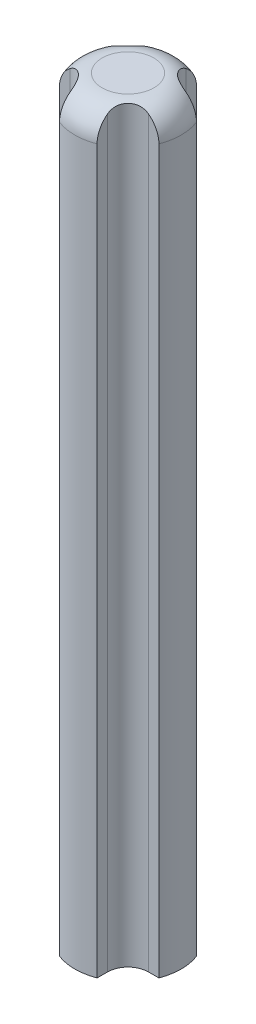
from build123d import *

# Parameters (mm, degrees)
SKETCH1_R           = 3.9
BOSS_EXTRUDE1_DEPTH = 55
FILLET1_R           = 2
SKETCH2_W           = 2.5
SKETCH2_H           = 2.5
CUT_EXTRUDE1_DEPTH  = 56.27585368
CIRPATTERN1_COUNT   = 4
FILLET2_R           = 1.5


with BuildPart() as part:
    # Sketch1 → Boss-Extrude1 (new body)
    with BuildSketch(Plane(origin=(0, 0, 0), x_dir=(1, 0, 0), z_dir=(0, 1, 0))):
        with Locations(Location((0, 0, 0), (0, 0, 270))):
            Circle(SKETCH1_R)
    extrude(amount=BOSS_EXTRUDE1_DEPTH)

    # Fillet1
    fillet1_edges = [part.edges().sort_by_distance(p)[0] for p in [
        (0, 55, -3.9),
    ]]
    fillet(fillet1_edges, radius=FILLET1_R)

    # Sketch2 → Cut-Extrude1 (cut, through all)
    with BuildSketch(Plane(origin=(0, 55, 0), x_dir=(1, 0, 0), z_dir=(0, 1, 0))):
        with Locations((2.628858223, -2.628858223)):
            Rectangle(SKETCH2_W, SKETCH2_H)
    cut_extrude1 = extrude(amount=-CUT_EXTRUDE1_DEPTH, mode=Mode.SUBTRACT)

    # CirPattern1: Cut-Extrude1 ×4 about axis
    cirpattern1_axis = Axis((0, 0, 0), (0, 1, 0))
    for i in range(1, CIRPATTERN1_COUNT):
        add(cut_extrude1.rotate(cirpattern1_axis, i * 360 / CIRPATTERN1_COUNT), mode=Mode.SUBTRACT)

    # Fillet2
    fillet2_edges = [part.edges().sort_by_distance(p)[0] for p in [
        (1.378858223, 27.499687451, -1.378858223),
        (-1.378858223, 27.499687451, -1.378858223),
        (-1.378858223, 27.499687451, 1.378858223),
        (1.378858223, 27.499687451, 1.378858223),
    ]]
    fillet(fillet2_edges, radius=FILLET2_R)


solid = part.part
